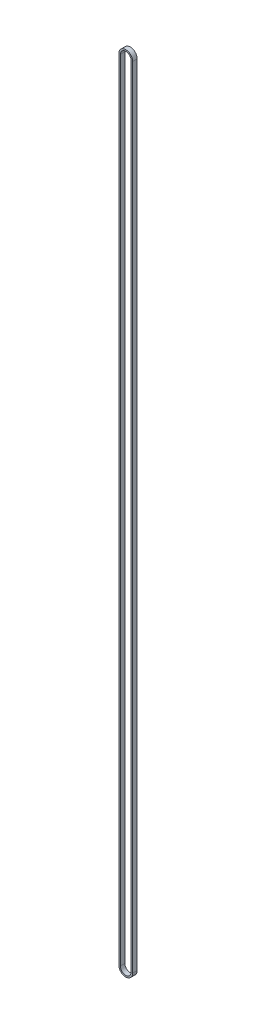
from build123d import *

# Parameters (mm, degrees)
EXTRUDE_THIN1_DEPTH = 3


with BuildPart() as part:
    # Sketch2 → Extrude-Thin1 (new, symmetric)
    with BuildSketch(Plane.XY):
        with BuildLine():
            Line((-9.11, -1041), (-9.11, 0))
            ThreePointArc((-9.11, 0), (0, 9.11), (9.11, 0))
            Line((9.11, 0), (9.11, -1041))
            ThreePointArc((9.11, -1041), (0, -1050.11), (-9.11, -1041))
        make_face()
        with BuildLine():
            Line((-7.11, -1041), (-7.11, 0))
            ThreePointArc((-7.11, 0), (0, 7.11), (7.11, 0))
            Line((7.11, 0), (7.11, -1041))
            ThreePointArc((7.11, -1041), (0, -1048.11), (-7.11, -1041))
        make_face(mode=Mode.SUBTRACT)
    extrude(amount=EXTRUDE_THIN1_DEPTH, both=True)


solid = part.part
